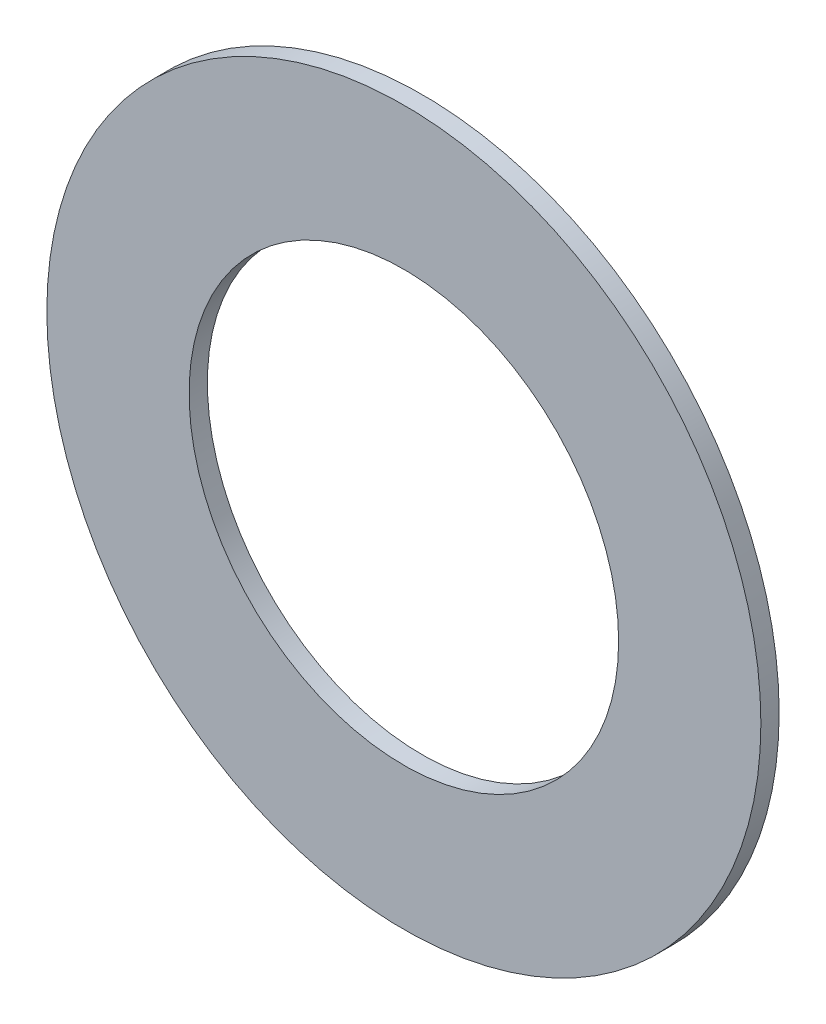
from build123d import *

# Parameters (mm, degrees)
BOSS_EXTRUDE1_DEPTH      = 0.4064
BOSS_EXTRUDE1_DEPTH_BACK = 0.4064
SKETCH3_R                = 15.875
SKETCH3_R_2              = 9.5504


with BuildPart() as part:
    # Sketch3 → Boss-Extrude1 (new, two sides: drawn at the far end of the back side and taken through both)
    with BuildSketch(Plane.XY.offset(-BOSS_EXTRUDE1_DEPTH_BACK)):
        Circle(SKETCH3_R)
        Circle(SKETCH3_R_2, mode=Mode.SUBTRACT)
    extrude(amount=BOSS_EXTRUDE1_DEPTH + BOSS_EXTRUDE1_DEPTH_BACK)


solid = part.part
